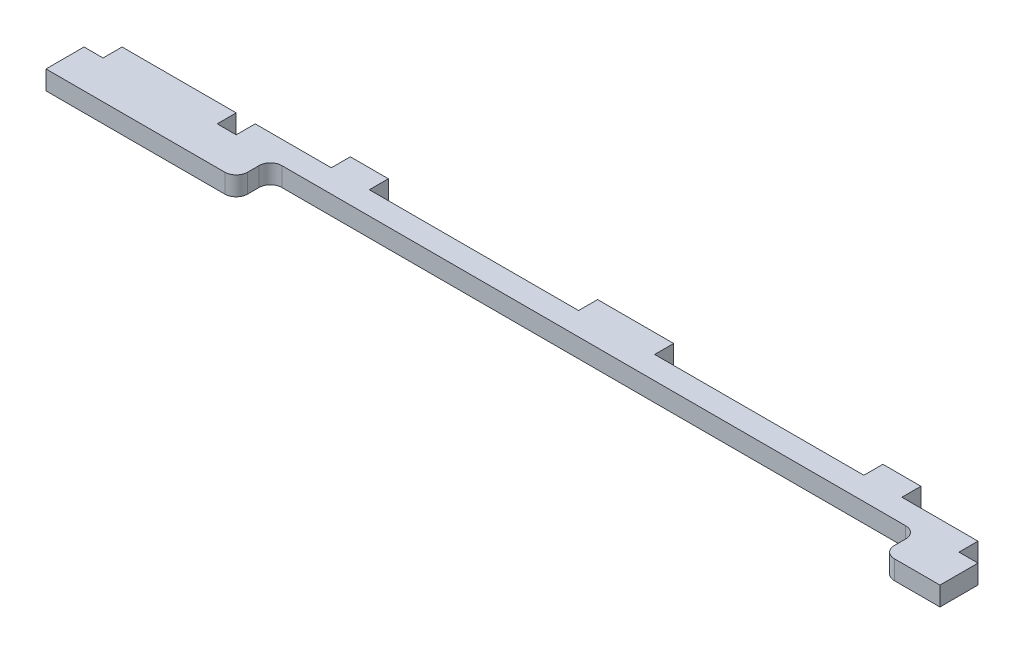
from build123d import *

# Parameters (mm, degrees)
EXTRUDE_2_DEPTH = 5


with BuildPart() as part:
    # 草图1 → 凸台-拉伸2 (new body)
    with BuildSketch(Plane(origin=(0, 0, 0), x_dir=(1, 0, 0), z_dir=(0, 1, 0))):
        with BuildLine():
            Line((-5, 0), (7, 0))
            ThreePointArc((7, 0), (9.121320344, 0.878679656), (10, 3))
            Line((10, 3), (10, 6))
            ThreePointArc((10, 6), (10.878679656, 8.121320344), (13, 9))
            Line((13, 9), (177, 9))
            ThreePointArc((177, 9), (179.121320344, 8.121320344), (180, 6))
            Line((180, 6), (180, 3))
            ThreePointArc((180, 3), (180.878679656, 0.878679656), (183, 0))
            Line((183, 0), (195, 0))
            Line((195, 0), (195, 10))
            Line((195, 10), (190, 10))
            Line((190, 10), (190, 15))
            Line((190, 15), (170, 15))
            Line((170, 15), (170, 20))
            Line((170, 20), (160, 20))
            Line((160, 20), (160, 15))
            Line((160, 15), (105, 15))
            Line((105, 15), (105, 20))
            Line((105, 20), (85, 20))
            Line((85, 20), (85, 15))
            Line((85, 15), (30, 15))
            Line((30, 15), (30, 20))
            Line((30, 20), (20, 20))
            Line((20, 20), (20, 15))
            Line((20, 15), (0, 15))
            Line((0, 15), (0, 10))
            Line((0, 10), (-5, 10))
            Line((-5, 10), (-5, 15))
            Line((-5, 15), (-35, 15))
            Line((-35, 15), (-35, 10))
            Line((-35, 10), (-40, 10))
            Line((-40, 10), (-40, 0))
            Line((-40, 0), (-5, 0))
        make_face()
    extrude(amount=EXTRUDE_2_DEPTH)


solid = part.part
